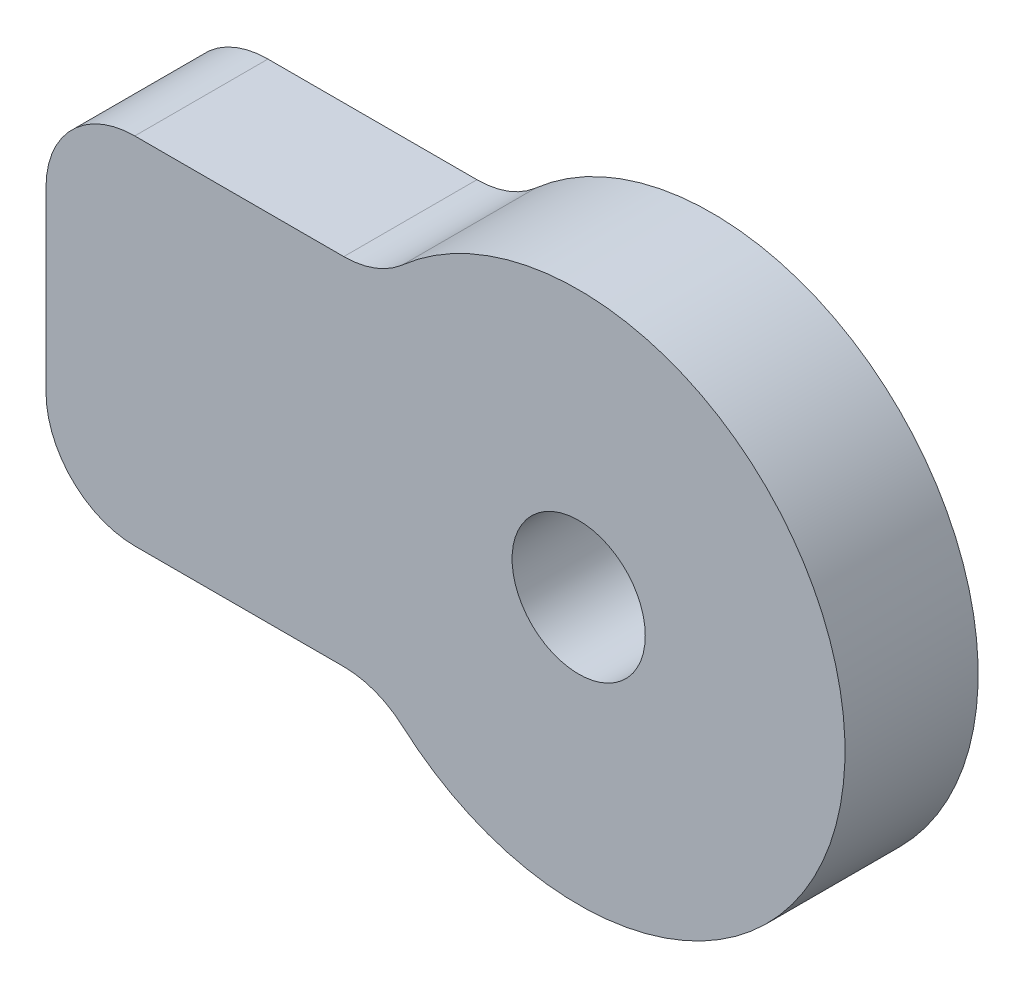
from build123d import *

# Parameters (mm, degrees)
SKETCH1_R           = 1.5
BOSS_EXTRUDE1_DEPTH = 3
FILLET1_R           = 2


with BuildPart() as part:
    # Sketch1 → Boss-Extrude1 (new body)
    with BuildSketch(Plane.XY):
        with BuildLine():
            Line((-4.472135955, 4), (-12, 4))
            Line((-12, 4), (-12, -4))
            Line((-12, -4), (-4.472135955, -4))
            ThreePointArc((-4.472135955, -4), (6, 0), (-4.472135955, 4))
        make_face()
        Circle(SKETCH1_R, mode=Mode.SUBTRACT)
    extrude(amount=BOSS_EXTRUDE1_DEPTH)

    # Fillet1
    fillet1_edges = [part.edges().sort_by_distance(p)[0] for p in [
        (-4.472135955, -4, 1.5),
        (-12, -4, 1.5),
        (-12, 4, 1.5),
        (-4.472135955, 4, 1.5),
    ]]
    fillet(fillet1_edges, radius=FILLET1_R)


solid = part.part
